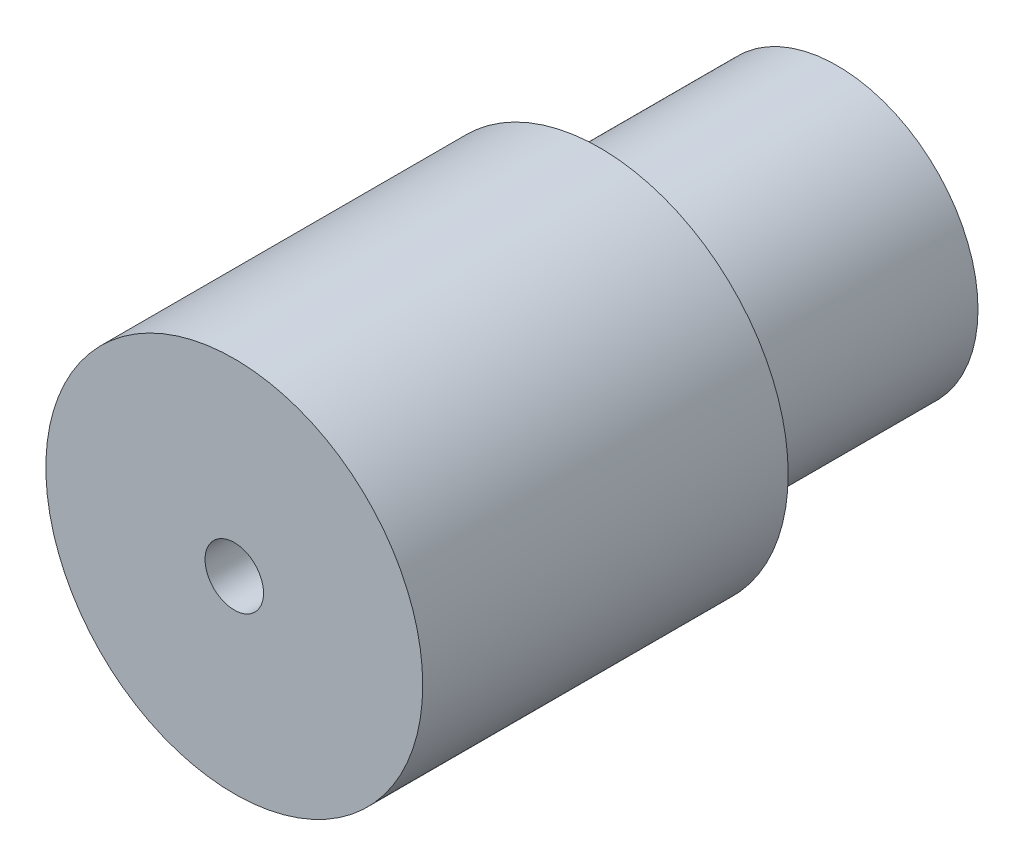
from build123d import *

# Parameters (mm, degrees)
SKETCH2_R               = 5.156250121
BOSS_EXTRUDE1_DEPTH     = 10
SKETCH3_R               = 3.85
BOSS_EXTRUDE2_DEPTH     = 6.5
CUT_EXTRUDE1_DEPTH      = 19.039507494
CUT_EXTRUDE1_DEPTH_BACK = 19.039507494
SKETCH5_R               = 0.8


with BuildPart() as part:
    # Sketch2 → Boss-Extrude1 (new body)
    with BuildSketch(Plane.XY):
        Circle(SKETCH2_R)
    extrude(amount=-BOSS_EXTRUDE1_DEPTH)

    # Sketch3 → Boss-Extrude2 (add)
    with BuildSketch(Plane(origin=(0, 0, -10), x_dir=(-1, 0, 0), z_dir=(0, 0, -1))):
        with Locations(Location((0, 0, 0), (0, 0, 180))):
            Circle(SKETCH3_R)
    extrude(amount=BOSS_EXTRUDE2_DEPTH)

    # Sketch5 → Cut-Extrude1 (cut, two sides: drawn at the far end of the back side and taken through both)
    with BuildSketch(Plane.XY.offset(-CUT_EXTRUDE1_DEPTH_BACK)):
        Circle(SKETCH5_R)
    extrude(amount=CUT_EXTRUDE1_DEPTH + CUT_EXTRUDE1_DEPTH_BACK, mode=Mode.SUBTRACT)


solid = part.part
